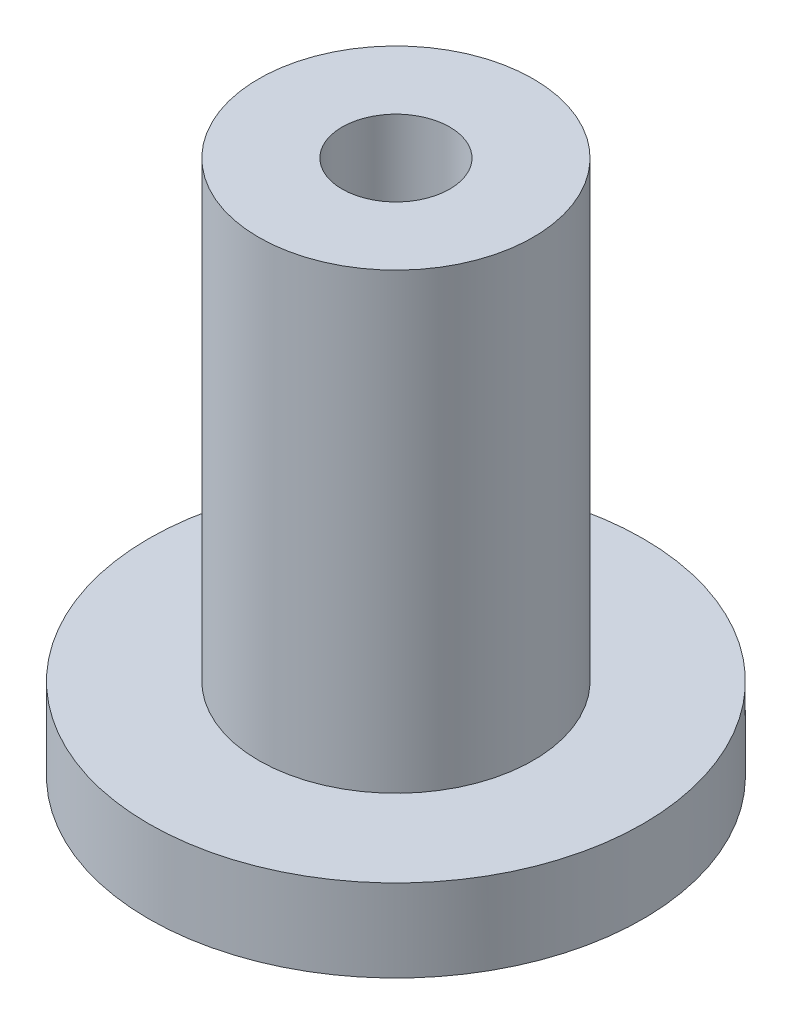
from build123d import *

# Parameters (mm, degrees)
SKETCH1_R           = 7.9375
SKETCH1_R_2         = 3.1115
BOSS_EXTRUDE1_DEPTH = 26.19375
SKETCH2_R           = 14.2875
BOSS_EXTRUDE2_DEPTH = 6.35
CHAMFER1_SIZE       = 1.5875
CHAMFER1_SIZE2      = 4.361620403
SKETCH3_R           = 4.6736
CUT_EXTRUDE1_DEPTH  = 6.477


with BuildPart() as part:
    # Sketch1 → Boss-Extrude1 (new body)
    with BuildSketch(Plane(origin=(0, 0, 0), x_dir=(1, 0, 0), z_dir=(0, 1, 0))):
        with Locations(Location((0, 0, 0), (0, 0, 270))):
            Circle(SKETCH1_R)
        with Locations(Location((0, 0, 0), (0, 0, 270))):
            Circle(SKETCH1_R_2, mode=Mode.SUBTRACT)
    extrude(amount=BOSS_EXTRUDE1_DEPTH)

    # Sketch2 → Boss-Extrude2 (add)
    with BuildSketch(Plane.XZ):
        with Locations(Location((0, 0, 0), (0, 0, 270))):
            Circle(SKETCH2_R)
    extrude(amount=BOSS_EXTRUDE2_DEPTH)

    # Chamfer1
    chamfer1_edges = [part.edges().sort_by_distance(p)[0] for p in [
        (0, -6.35, 14.2875),
    ]]
    chamfer1_side = [part.faces().sort_by_distance(p)[0] for p in [
        (0, -3.175, 14.2875),
    ]]
    chamfer(chamfer1_edges, length=CHAMFER1_SIZE, length2=CHAMFER1_SIZE2, reference=chamfer1_side[0])

    # Sketch3 → Cut-Extrude1 (cut)
    with BuildSketch(Plane.XZ.offset(6.35)):
        with Locations(Location((0, 0, 0), (0, 0, 270))):
            Circle(SKETCH3_R)
    extrude(amount=-CUT_EXTRUDE1_DEPTH, mode=Mode.SUBTRACT)


solid = part.part
